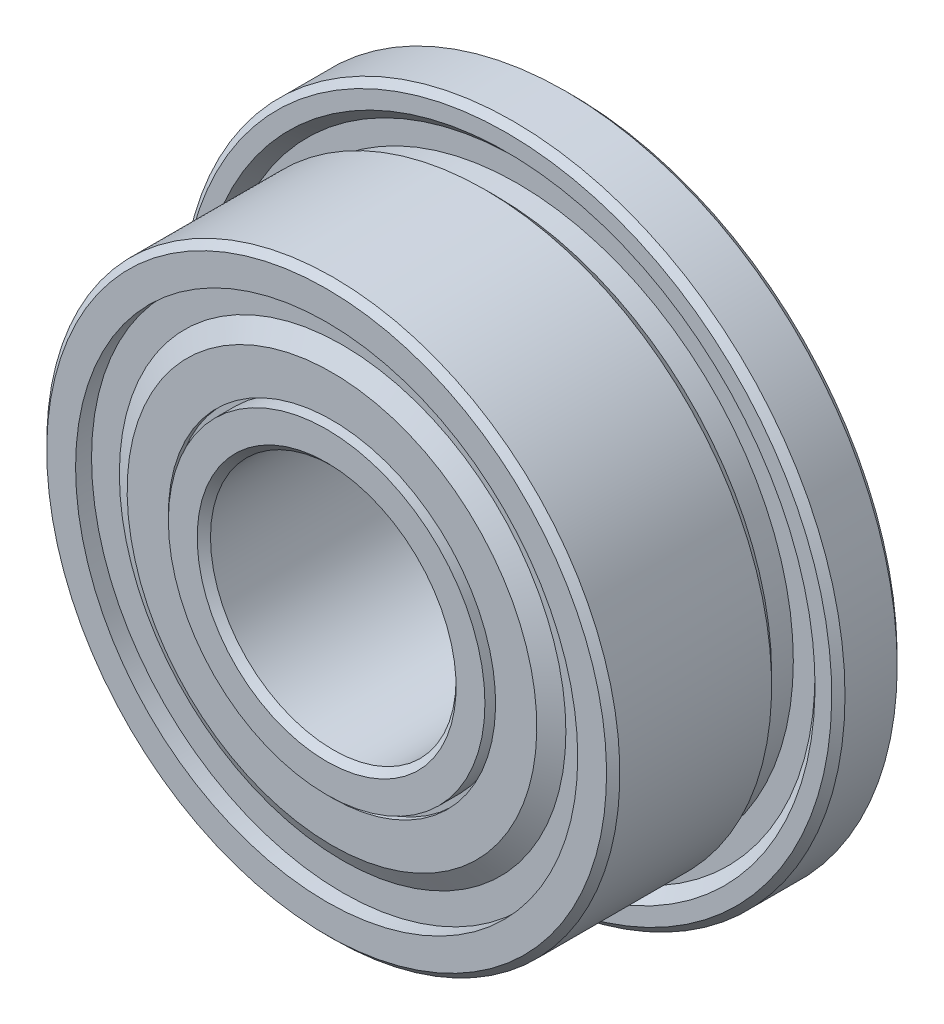
from build123d import *

# Parameters (mm, degrees)
FILLET1_SIZE      = 0.08125
FILLET2_SIZE      = 0.08125
CIRPATTERN3_COUNT = 12
SKETCH8_W         = 0.26
SKETCH8_H         = 0.216666667


with BuildPart() as part:
    # Sketch2 → Revolve1 (revolve)
    with BuildSketch(Plane(origin=(0, 0, 0), x_dir=(0, 0, -1), z_dir=(1, 0, 0)), mode=Mode.PRIVATE) as revolve1_sk:
        with BuildLine():
            Line((1.5, 4.05), (0.7, 4.05))
            Line((0.7, 4.05), (0.7, 3.765165043))
            Line((0.7, 3.765165043), (0.832582521, 3.632582521))
            Line((0.832582521, 3.632582521), (0.832582521, 3.367417479))
            Line((0.832582521, 3.367417479), (0.567417479, 3.367417479))
            Line((0.567417479, 3.367417479), (0.434834957, 3.5))
            Line((0.434834957, 3.5), (-1.5, 3.5))
            Line((-1.5, 3.5), (-1.5, 2.85))
            Line((-1.5, 2.85), (-0.357071421, 2.85))
            ThreePointArc((-0.357071421, 2.85), (0, 3), (0.357071421, 2.85))
            Line((0.357071421, 2.85), (1.5, 2.85))
            Line((1.5, 2.85), (1.5, 4.05))
        make_face()
        with BuildLine():
            Line((1.5, 1.5), (-1.5, 1.5))
            Line((-1.5, 1.5), (-1.5, 2.15))
            Line((-1.5, 2.15), (-0.357071421, 2.15))
            ThreePointArc((-0.357071421, 2.15), (0, 2), (0.357071421, 2.15))
            Line((0.357071421, 2.15), (1.5, 2.15))
            Line((1.5, 2.15), (1.5, 1.5))
        make_face()
    revolve(revolve1_sk.sketch.rotate(Axis((0, 0, 0), (0, 0, -1)), 180), axis=Axis((0, 0, 0), (0, 0, -1)))

    # Fillet1
    fillet1_edges = [part.edges().sort_by_distance(p)[0] for p in [
        (0, 3.5, 1.5),
        (0, 4.05, -1.5),
        (0, 4.05, -0.7),
    ]]
    chamfer(fillet1_edges, length=FILLET1_SIZE)

    # Fillet2
    fillet2_edges = [part.edges().sort_by_distance(p)[0] for p in [
        (0, 1.5, -1.5),
        (0, 1.5, 1.5),
    ]]
    chamfer(fillet2_edges, length=FILLET2_SIZE)

    # Sketch8 → Cut-Revolve1 (revolve, cut)
    with BuildSketch(Plane(origin=(0, 0, 0), x_dir=(0, 0, -1), z_dir=(1, 0, 0)), mode=Mode.PRIVATE) as cut_revolve1_sk:
        with Locations((-1.37, 2.958333334)):
            Rectangle(SKETCH8_W, SKETCH8_H)
        with Locations((1.37, 2.958333334)):
            Rectangle(SKETCH8_W, SKETCH8_H)
        with Locations((1.37, 2.041666667)):
            Rectangle(SKETCH8_W, SKETCH8_H)
        with Locations((-1.37, 2.041666667)):
            Rectangle(SKETCH8_W, SKETCH8_H)
    revolve(cut_revolve1_sk.sketch.rotate(Axis((0, 0, 0), (0, 0, -1)), 180), axis=Axis((0, 0, 0), (0, 0, -1)), mode=Mode.SUBTRACT)


with BuildPart() as body_2:
    # Sketch7 → Revolve3 (revolve)
    with BuildSketch(Plane.XY):
        with BuildLine():
            Line((0, 3), (0, 2))
            ThreePointArc((0, 2), (-0.5, 2.5), (0, 3))
        make_face()
    revolve(axis=Axis((0, 3, 0), (0, -1, 0)))


with BuildPart() as cirpattern3_1:
    # CirPattern3: pattern copy
    add(body_2.part.rotate(Axis((0, 0, 0), (0, 0, 1)), 1 * 360 / CIRPATTERN3_COUNT))


with BuildPart() as cirpattern3_2:
    # CirPattern3: pattern copy
    add(body_2.part.rotate(Axis((0, 0, 0), (0, 0, 1)), 2 * 360 / CIRPATTERN3_COUNT))


with BuildPart() as cirpattern3_3:
    # CirPattern3: pattern copy
    add(body_2.part.rotate(Axis((0, 0, 0), (0, 0, 1)), 3 * 360 / CIRPATTERN3_COUNT))


with BuildPart() as cirpattern3_4:
    # CirPattern3: pattern copy
    add(body_2.part.rotate(Axis((0, 0, 0), (0, 0, 1)), 4 * 360 / CIRPATTERN3_COUNT))


with BuildPart() as cirpattern3_5:
    # CirPattern3: pattern copy
    add(body_2.part.rotate(Axis((0, 0, 0), (0, 0, 1)), 5 * 360 / CIRPATTERN3_COUNT))


with BuildPart() as cirpattern3_6:
    # CirPattern3: pattern copy
    add(body_2.part.rotate(Axis((0, 0, 0), (0, 0, 1)), 6 * 360 / CIRPATTERN3_COUNT))


with BuildPart() as cirpattern3_7:
    # CirPattern3: pattern copy
    add(body_2.part.rotate(Axis((0, 0, 0), (0, 0, 1)), 7 * 360 / CIRPATTERN3_COUNT))


with BuildPart() as cirpattern3_8:
    # CirPattern3: pattern copy
    add(body_2.part.rotate(Axis((0, 0, 0), (0, 0, 1)), 8 * 360 / CIRPATTERN3_COUNT))


with BuildPart() as cirpattern3_9:
    # CirPattern3: pattern copy
    add(body_2.part.rotate(Axis((0, 0, 0), (0, 0, 1)), 9 * 360 / CIRPATTERN3_COUNT))


with BuildPart() as cirpattern3_10:
    # CirPattern3: pattern copy
    add(body_2.part.rotate(Axis((0, 0, 0), (0, 0, 1)), 10 * 360 / CIRPATTERN3_COUNT))


with BuildPart() as cirpattern3_11:
    # CirPattern3: pattern copy
    add(body_2.part.rotate(Axis((0, 0, 0), (0, 0, 1)), 11 * 360 / CIRPATTERN3_COUNT))


with BuildPart() as body_14:
    # Sketch9 → Revolve4 (revolve)
    with BuildSketch(Plane(origin=(0, 0, 0), x_dir=(0, 0, -1), z_dir=(1, 0, 0)), mode=Mode.PRIVATE) as revolve4_sk:
        Polygon((-1.24, 3.066666667), (-1.24, 2.70952381), (-1.37, 2.484357205), (-1.37, 1.998333333), (-1.435, 1.998333333), (-1.435, 2.501773902), (-1.305, 2.726940507), (-1.305, 3.066666667), align=None)
        Polygon((1.24, 3.066666667), (1.24, 2.70952381), (1.37, 2.484357205), (1.37, 1.998333333), (1.435, 1.998333333), (1.435, 2.501773902), (1.305, 2.726940507), (1.305, 3.066666667), align=None)
    revolve(revolve4_sk.sketch.rotate(Axis((0, 0, 0), (0, 0, -1)), 180), axis=Axis((0, 0, 0), (0, 0, -1)))


solid = Compound([part.part, body_2.part, cirpattern3_1.part, cirpattern3_2.part, cirpattern3_3.part, cirpattern3_4.part, cirpattern3_5.part, cirpattern3_6.part, cirpattern3_7.part, cirpattern3_8.part, cirpattern3_9.part, cirpattern3_10.part, cirpattern3_11.part, body_14.part])
